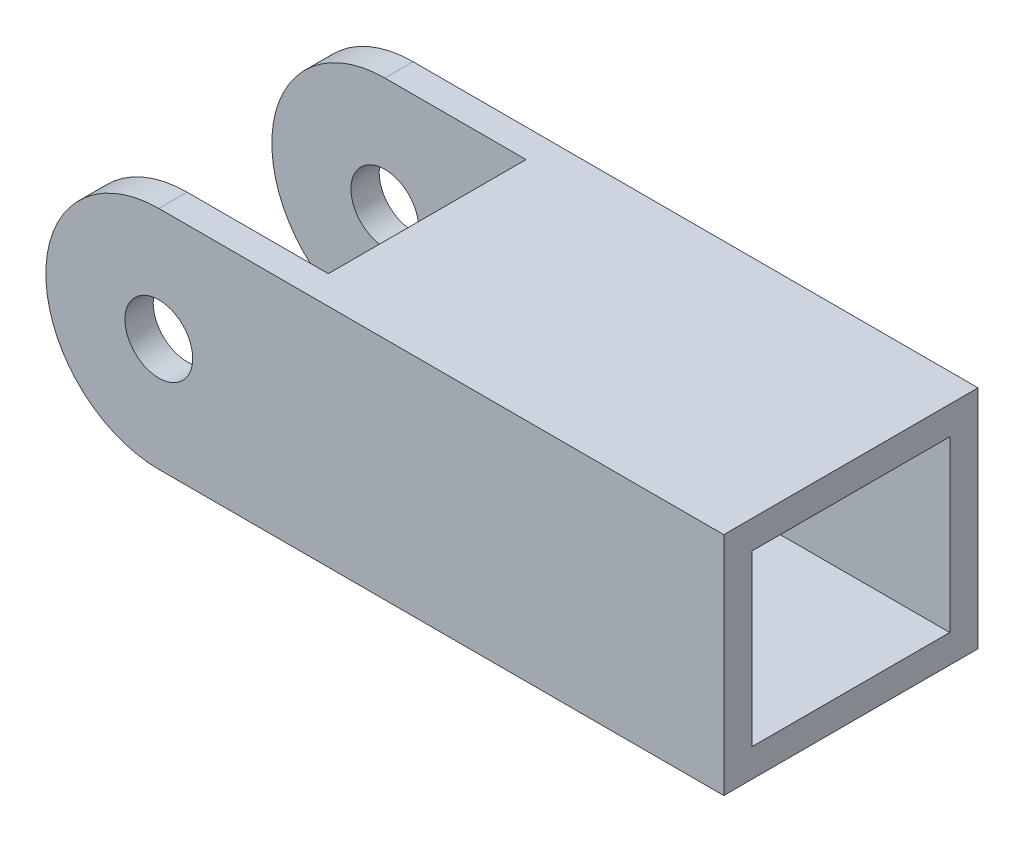
from build123d import *

# Parameters (mm, degrees)
DODANIE_WYCI_GNI_CIE1_DEPTH = 5
SZKIC2_W                    = 75
SZKIC2_H                    = 35
DODANIE_WYCI_GNI_CIE2_DEPTH = 5
SZKIC3_R                    = 6
WYTNIJ_WYCI_GNI_CIE1_DEPTH  = 86.586213843


with BuildPart() as part:
    # Szkic1 → Dodanie-wyciągnięcie1 (new body)
    with BuildSketch(Plane.XY):
        with BuildLine():
            Line((-50, -20), (50, -20))
            Line((50, -20), (50, 20))
            Line((50, 20), (-50, 20))
            ThreePointArc((-50, 20), (-70, 0), (-50, -20))
        make_face()
    extrude(amount=DODANIE_WYCI_GNI_CIE1_DEPTH)


with BuildPart() as body_2:
    # Lustro2: mirrored copy
    add(part.part.mirror(Plane.XY.offset(22.5)))


with BuildPart() as part_1:
    add(part.part)

    add(body_2.part)  # Dodanie-wyciągnięcie2 merges body 2
    # Szkic2 → Dodanie-wyciągnięcie2 (add)
    with BuildSketch(Plane(origin=(0, 20, 0), x_dir=(1, 0, 0), z_dir=(0, 1, 0))):
        with Locations((12.5, -22.5)):
            Rectangle(SZKIC2_W, SZKIC2_H)
    dodanie_wyci_gni_cie2 = extrude(amount=-DODANIE_WYCI_GNI_CIE2_DEPTH)

    # Lustro5: Dodanie-wyciągnięcie2 across plane
    add(dodanie_wyci_gni_cie2.mirror(Plane.ZX))

    # Szkic3 → Wytnij-wyciągnięcie1 (cut, through all)
    with BuildSketch(Plane(origin=(0, 0, 0), x_dir=(-1, 0, 0), z_dir=(0, 0, -1))):
        with Locations((50, 0)):
            Circle(SZKIC3_R)
    extrude(amount=-WYTNIJ_WYCI_GNI_CIE1_DEPTH, mode=Mode.SUBTRACT)


solid = part_1.part
